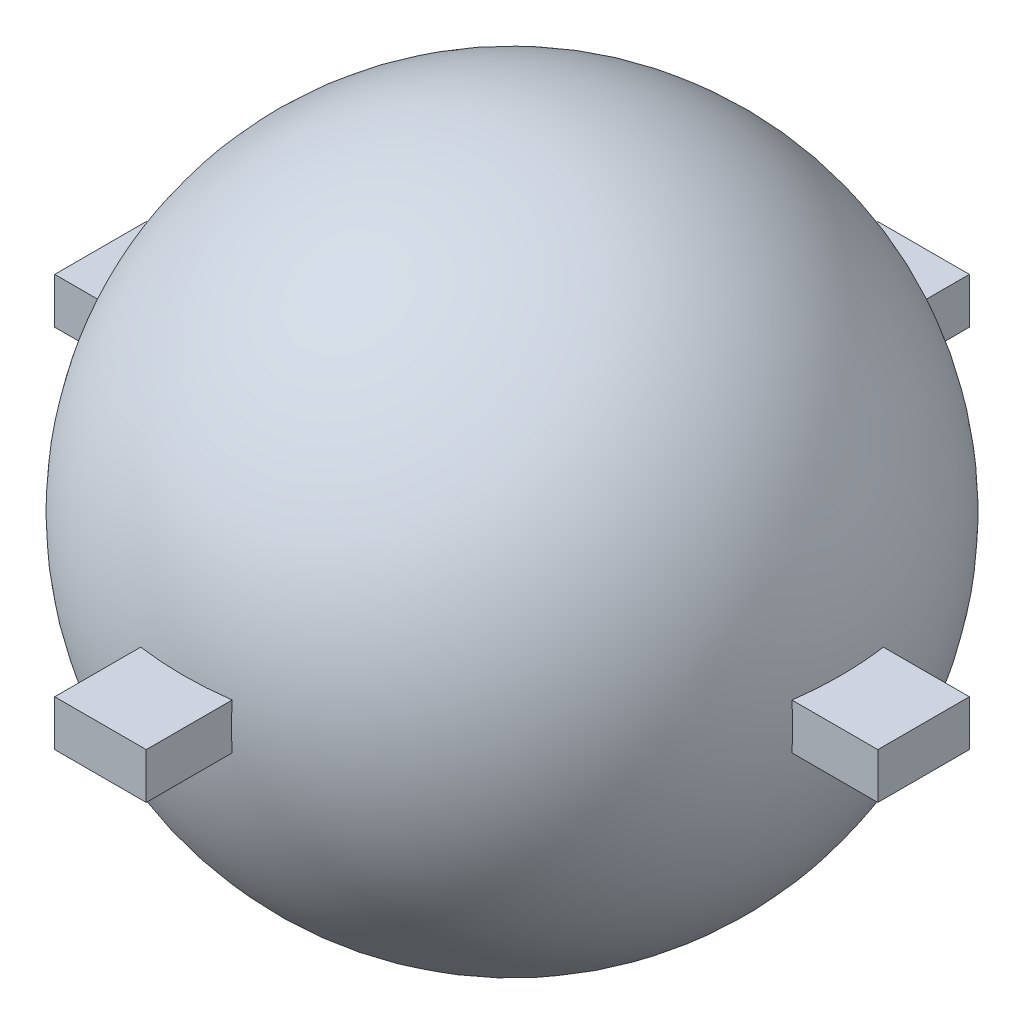
from build123d import *

# Parameters (mm, degrees)
SHELL1_T                 = 3.175
BOSS_EXTRUDE1_REACH      = 730.747
BOSS_EXTRUDE1_END_RADIUS = 274.32
SKETCH4_W                = 76.2
SKETCH4_H                = 38.1
CIRPATTERN1_COUNT        = 4


with BuildPart() as part:
    # Sketch1 → Revolve6 (revolve)
    with BuildSketch(Plane(origin=(0, 0, 0), x_dir=(1, 0, 0), z_dir=(0, 1, 0))):
        with BuildLine():
            Line((-274.32, 0), (274.32, 0))
            ThreePointArc((274.32, 0), (0, 274.32), (-274.32, 0))
        make_face()
    revolve(axis=Axis((-274.32, 0, 0), (1, 0, 0)))

    # Shell1 (no face opened: a closed hollow body)
    add(offset(amount=-SHELL1_T, mode=Mode.PRIVATE), mode=Mode.SUBTRACT)

    # Boss-Extrude1: up to this sphere (the profile starts outside it)
    boss_extrude1_end = Location((0, 0, 0)) * Sphere(BOSS_EXTRUDE1_END_RADIUS, mode=Mode.PRIVATE)
    # Sketch4 → Boss-Extrude1 (add, up to the surface)
    with BuildSketch(Plane.XY.offset(342.5825), mode=Mode.PRIVATE) as boss_extrude1_sk1:
        Rectangle(SKETCH4_W, SKETCH4_H)
    boss_extrude1_tool1 = extrude(boss_extrude1_sk1.sketch, amount=-BOSS_EXTRUDE1_REACH, mode=Mode.PRIVATE) - boss_extrude1_end
    boss_extrude1 = boss_extrude1_tool1.solids().sort_by_distance((0, 0, 342.5825))[0]
    add(boss_extrude1)

    # CirPattern1: Boss-Extrude1 ×4 about axis
    cirpattern1_axis = Axis((0, 0, 0), (0, 1, 0))
    for i in range(1, CIRPATTERN1_COUNT):
        add(boss_extrude1.rotate(cirpattern1_axis, i * 360 / CIRPATTERN1_COUNT))


solid = part.part
